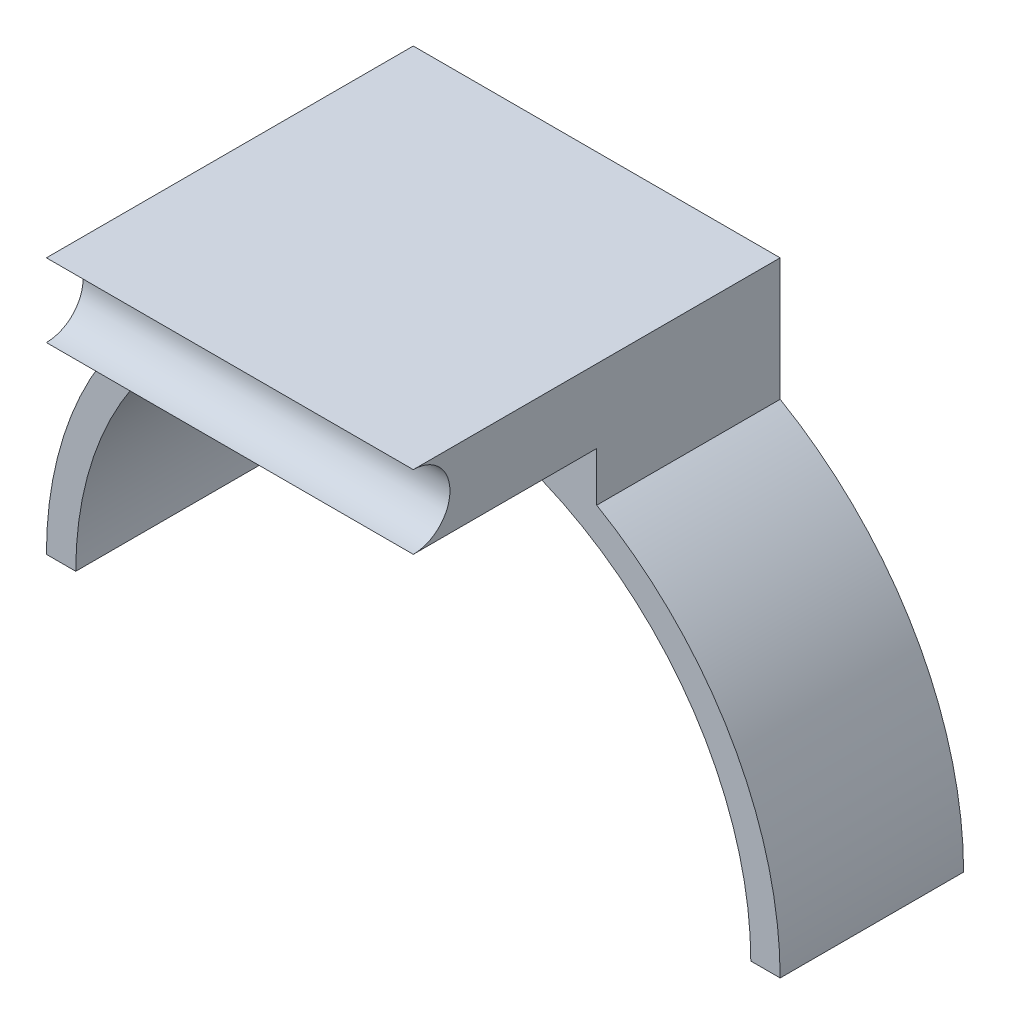
from build123d import *

# Parameters (mm, degrees)
SKETCH_1_W          = 50
SKETCH_1_H          = 10
EXTRUDE_1_DEPTH     = 50
EXTRUDE_3_DEPTH     = 25
SKETCH_5_R          = 5
CUT_EXTRUDE_2_DEPTH = 106.59356041


with BuildPart() as part:
    # 草图1 → 凸台-拉伸1 (new body)
    with BuildSketch(Plane.XY):
        Rectangle(SKETCH_1_W, SKETCH_1_H)
    extrude(amount=EXTRUDE_1_DEPTH)

    # 草图4 → 凸台-拉伸3 (add)
    with BuildSketch(Plane(origin=(0, 0, 0), x_dir=(-1, 0, 0), z_dir=(0, 0, -1))):
        with BuildLine():
            Line((-25, -5), (25, -5))
            Line((25, -5), (25, -11.698729811))
            ThreePointArc((25, -11.698729811), (43.301270189, -30), (50, -55))
            Line((50, -55), (46, -55))
            ThreePointArc((46, -55), (0, -9), (-46, -55))
            Line((-46, -55), (-50, -55))
            ThreePointArc((-50, -55), (-43.301270189, -30), (-25, -11.698729811))
            Line((-25, -11.698729811), (-25, -5))
        make_face()
    extrude(amount=-EXTRUDE_3_DEPTH)

    # 草图5 → 切除-拉伸2 (cut, through all)
    with BuildSketch(Plane(origin=(25, 0, 0), x_dir=(0, 0, -1), z_dir=(1, 0, 0))):
        with Locations((-50, 0)):
            Circle(SKETCH_5_R)
    extrude(amount=-CUT_EXTRUDE_2_DEPTH, mode=Mode.SUBTRACT)


solid = part.part
